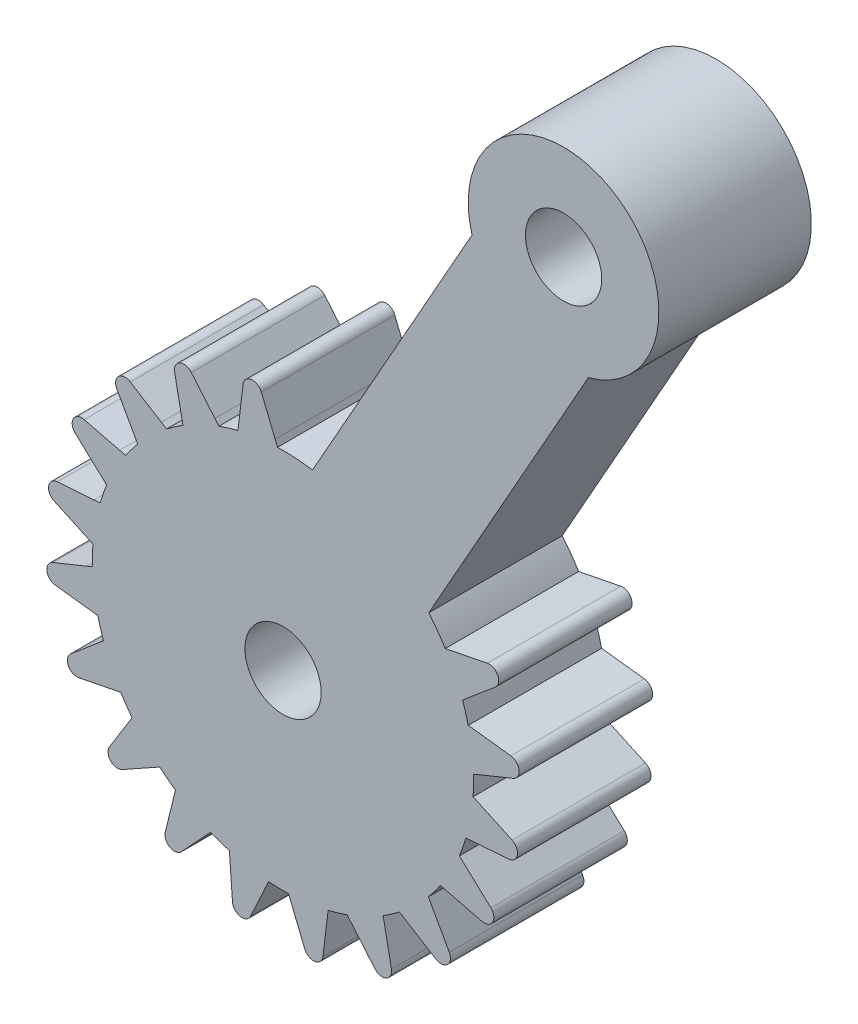
from build123d import *

# Parameters (mm, degrees)
BOSS_EXTRUDE1_DEPTH      = 7
BOSS_EXTRUDE2_START      = 1
SKETCH2_R                = 5
BOSS_EXTRUDE2_DEPTH      = 1
SKETCH3_W                = 5
SKETCH3_H                = 1
F_4_0_4_DIAMETER_HOLE1_D = 4


with BuildPart() as part:
    # Sketch1 → Boss-Extrude1 (new body)
    with BuildSketch(Plane(origin=(0, 0, 74), x_dir=(-1, 0, 0), z_dir=(0, 0, -1))):
        with BuildLine():
            Line((-9.792858273, 22.023664764), (-18.163987442, 36.890703242))
            ThreePointArc((-18.163987442, 36.890703242), (-25.418865109, 42.641693781), (-24.263539525, 33.456250682))
            Line((-24.263539525, 33.456250682), (-15.892410356, 18.589212204))
            ThreePointArc((-15.892410356, 18.589212204), (-16.346796769, 18.007963525), (-16.757092444, 17.394795929))
            Line((-16.757092444, 17.394795929), (-18.965700238, 17.831555144))
            ThreePointArc((-18.965700238, 17.831555144), (-19.514808102, 17.55458812), (-19.379909826, 16.954560925))
            Line((-19.379909826, 16.954560925), (-17.910889228, 15.715657441))
            Line((-17.910889228, 15.715657441), (-17.664910308, 15.504807423))
            ThreePointArc((-17.664910308, 15.504807423), (-17.827013037, 15.010242888), (-17.963165175, 14.507914341))
            Line((-17.963165175, 14.507914341), (-20.19864203, 14.240799695))
            ThreePointArc((-20.19864203, 14.240799695), (-20.635287125, 13.80770474), (-20.32157264, 13.278730827))
            Line((-20.32157264, 13.278730827), (-18.541608797, 12.554415925))
            Line((-18.541608797, 12.554415925), (-18.242512703, 12.429897308))
            ThreePointArc((-18.242512703, 12.429897308), (-18.243852713, 11.909445986), (-18.218113034, 11.389629824))
            Line((-18.218113034, 11.389629824), (-20.261634899, 10.444788361))
            ThreePointArc((-20.261634899, 10.444788361), (-20.543075361, 9.897959827), (-20.081253227, 9.491818847))
            Line((-20.081253227, 9.491818847), (-18.164581401, 9.352993516))
            Line((-18.164581401, 9.352993516), (-17.841645743, 9.32699505))
            ThreePointArc((-17.841645743, 9.32699505), (-17.682091866, 8.831602343), (-17.496979948, 8.345181793))
            Line((-17.496979948, 8.345181793), (-19.148512665, 6.815101178))
            ThreePointArc((-19.148512665, 6.815101178), (-19.247199139, 6.208066452), (-18.682475725, 5.964514314))
            Line((-18.682475725, 5.964514314), (-16.816713109, 6.424767746))
            Line((-16.816713109, 6.424767746), (-16.501549079, 6.499834341))
            ThreePointArc((-16.501549079, 6.499834341), (-16.196719559, 6.077992739), (-15.870355447, 5.672582033))
            Line((-15.870355447, 5.672582033), (-16.968235486, 3.707037218))
            ThreePointArc((-16.968235486, 3.707037218), (-16.874507855, 3.099217089), (-16.262162222, 3.042094373))
            Line((-16.262162222, 3.042094373), (-14.62994266, 4.056373754))
            Line((-14.62994266, 4.056373754), (-14.353400709, 4.22515737))
            ThreePointArc((-14.353400709, 4.22515737), (-13.933134384, 3.918159668), (-13.497464871, 3.633443231))
            Line((-13.497464871, 3.633443231), (-13.934224085, 1.424835437))
            ThreePointArc((-13.934224085, 1.424835437), (-13.657257061, 0.875727573), (-13.057229867, 1.010625848))
            Line((-13.057229867, 1.010625848), (-11.818326382, 2.479646446))
            Line((-11.818326382, 2.479646446), (-11.607476364, 2.725625367))
            ThreePointArc((-11.607476364, 2.725625367), (-11.112911829, 2.563522638), (-10.610583282, 2.427370499))
            Line((-10.610583282, 2.427370499), (-10.343468637, 0.191893645))
            ThreePointArc((-10.343468637, 0.191893645), (-9.910373682, -0.24475145), (-9.381399768, 0.068963034))
            Line((-9.381399768, 0.068963034), (-8.657084866, 1.848926878))
            Line((-8.657084866, 1.848926878), (-8.532566249, 2.148022972))
            ThreePointArc((-8.532566249, 2.148022972), (-8.012114927, 2.146682961), (-7.492298765, 2.17242264))
            Line((-7.492298765, 2.17242264), (-6.547457302, 0.128900776))
            ThreePointArc((-6.547457302, 0.128900776), (-6.000628768, -0.152539686), (-5.594487788, 0.309282448))
            Line((-5.594487788, 0.309282448), (-5.455662457, 2.225954274))
            Line((-5.455662457, 2.225954274), (-5.429663991, 2.548889932))
            ThreePointArc((-5.429663991, 2.548889932), (-4.934271284, 2.708443809), (-4.447850734, 2.893555727))
            Line((-4.447850734, 2.893555727), (-2.917770119, 1.24202301))
            ThreePointArc((-2.917770119, 1.24202301), (-2.310735394, 1.143336536), (-2.067183255, 1.70805995))
            Line((-2.067183255, 1.70805995), (-2.527436687, 3.573822566))
            Line((-2.527436687, 3.573822566), (-2.602503283, 3.888986596))
            ThreePointArc((-2.602503283, 3.888986596), (-2.18066168, 4.193816116), (-1.775250975, 4.520180228))
            Line((-1.775250975, 4.520180228), (0.19029384, 3.422300189))
            ThreePointArc((0.19029384, 3.422300189), (0.79811397, 3.51602782), (0.855236686, 4.128373453))
            Line((0.855236686, 4.128373453), (-0.159042695, 5.760593015))
            Line((-0.159042695, 5.760593015), (-0.327826311, 6.037134965))
            ThreePointArc((-0.327826311, 6.037134965), (-0.020828609, 6.457401291), (0.263887828, 6.893070804))
            Line((0.263887828, 6.893070804), (2.472495622, 6.45631159))
            ThreePointArc((2.472495622, 6.45631159), (3.021603486, 6.733278614), (2.88670521, 7.333305808))
            Line((2.88670521, 7.333305808), (1.417684612, 8.572209293))
            Line((1.417684612, 8.572209293), (1.171705692, 8.783059311))
            ThreePointArc((1.171705692, 8.783059311), (1.333808421, 9.277623846), (1.469960559, 9.779952393))
            Line((1.469960559, 9.779952393), (3.705437414, 10.047067038))
            ThreePointArc((3.705437414, 10.047067038), (4.142082509, 10.480161993), (3.828368024, 11.009135907))
            Line((3.828368024, 11.009135907), (2.048404181, 11.733450809))
            Line((2.048404181, 11.733450809), (1.749308087, 11.857969426))
            ThreePointArc((1.749308087, 11.857969426), (1.750648097, 12.378420747), (1.724908418, 12.89823691))
            Line((1.724908418, 12.89823691), (3.768430283, 13.843078373))
            ThreePointArc((3.768430283, 13.843078373), (4.049870744, 14.389906907), (3.588048611, 14.796047887))
            Line((3.588048611, 14.796047887), (1.671376785, 14.934873217))
            Line((1.671376785, 14.934873217), (1.348441127, 14.960871684))
            ThreePointArc((1.348441127, 14.960871684), (1.188887249, 15.45626439), (1.003775332, 15.942684941))
            Line((1.003775332, 15.942684941), (2.655308048, 17.472765555))
            ThreePointArc((2.655308048, 17.472765555), (2.753994523, 18.079800281), (2.189271109, 18.32335242))
            Line((2.189271109, 18.32335242), (0.323508493, 17.863098988))
            Line((0.323508493, 17.863098988), (0.008344463, 17.788032392))
            ThreePointArc((0.008344463, 17.788032392), (-0.296485057, 18.209873994), (-0.622849169, 18.6152847))
            Line((-0.622849169, 18.6152847), (0.47503087, 20.580829515))
            ThreePointArc((0.47503087, 20.580829515), (0.381303238, 21.188649645), (-0.231042394, 21.245772361))
            Line((-0.231042394, 21.245772361), (-1.863261956, 20.23149298))
            Line((-1.863261956, 20.23149298), (-2.139803907, 20.062709363))
            ThreePointArc((-2.139803907, 20.062709363), (-2.560070232, 20.369707066), (-2.995739745, 20.654423502))
            Line((-2.995739745, 20.654423502), (-2.558980531, 22.863031297))
            ThreePointArc((-2.558980531, 22.863031297), (-2.835947555, 23.412139161), (-3.43597475, 23.277240885))
            Line((-3.43597475, 23.277240885), (-4.674878234, 21.808220287))
            Line((-4.674878234, 21.808220287), (-4.885728252, 21.562241367))
            ThreePointArc((-4.885728252, 21.562241367), (-5.380292787, 21.724344095), (-5.882621334, 21.860496234))
            Line((-5.882621334, 21.860496234), (-6.149735979, 24.095973089))
            ThreePointArc((-6.149735979, 24.095973089), (-6.582830934, 24.532618183), (-7.111804848, 24.218903699))
            Line((-7.111804848, 24.218903699), (-7.83611975, 22.438939856))
            Line((-7.83611975, 22.438939856), (-7.960638367, 22.139843762))
            ThreePointArc((-7.960638367, 22.139843762), (-8.879420123, 22.123890361), (-9.792858273, 22.023664764))
        make_face()
    extrude(amount=-BOSS_EXTRUDE1_DEPTH)

    # Sketch2 → Boss-Extrude2 (add)
    with BuildSketch(Plane(origin=(0, 0, 74), x_dir=(-1, 0, 0), z_dir=(0, 0, -1)).offset(BOSS_EXTRUDE2_START)):
        with Locations((-22.965684708, 38.284870865)):
            Circle(SKETCH2_R)
    extrude(amount=-BOSS_EXTRUDE2_DEPTH)

    # Sketch3 → Revolve1 (revolve)
    with BuildSketch(Plane(origin=(0, 12.143933367, 0), x_dir=(1, 0, 0), z_dir=(0, 1, 0))):
        with Locations((10.746602308, -73.5)):
            Rectangle(SKETCH3_W, SKETCH3_H)
    revolve(axis=Axis((8.246602308, 12.143933367, 73), (0, 0, 1)))

    # Ø4.0 (4) Diameter Hole1 (through all)
    with Locations(Plane.XY.offset(81)):
        with Locations((22.965684708, 38.284870865), (8.246602308, 12.143933367)):
            Hole(F_4_0_4_DIAMETER_HOLE1_D / 2)


solid = part.part
